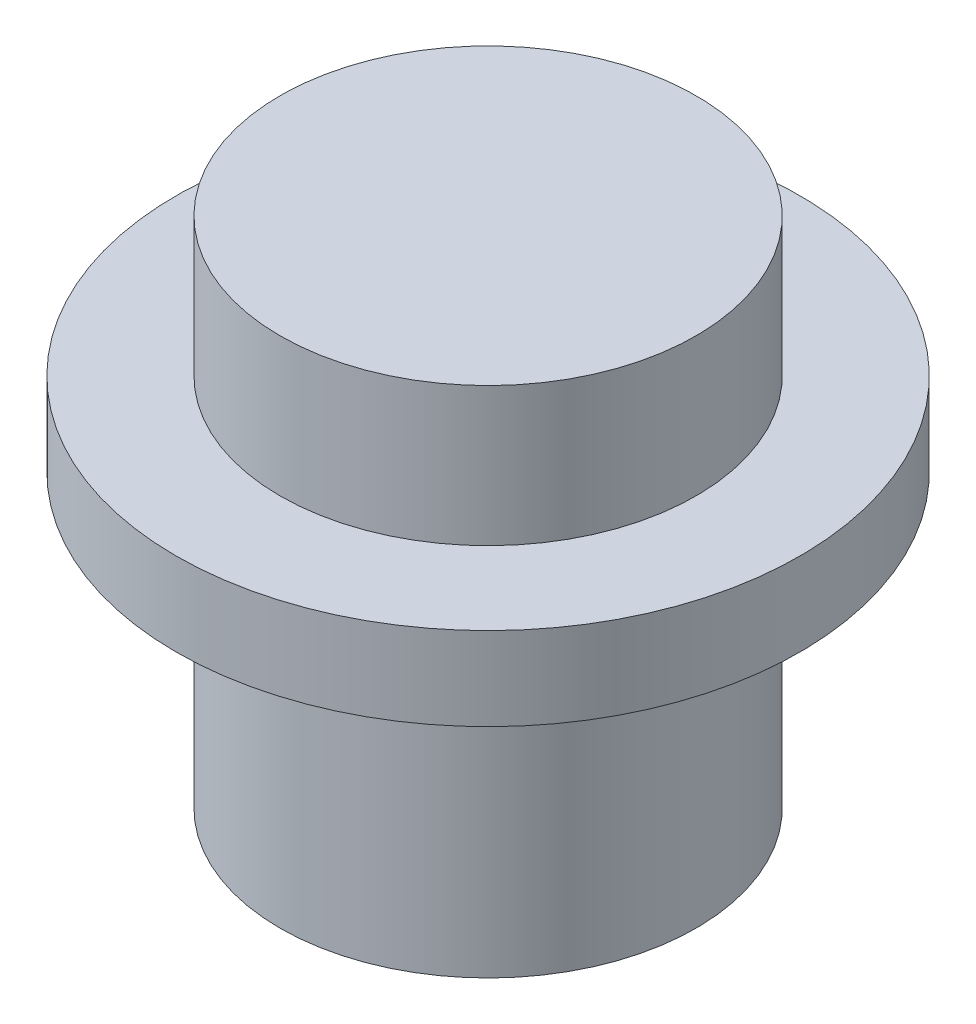
from build123d import *

# Parameters (mm, degrees)
SKETCH_1_R               = 3
PLUNGER_1_DEPTH          = 7.4
SKETCH_2_R               = 4.5
RETENTION_FLANGE_2_DEPTH = 1.2


with BuildPart() as part:
    # Эскиз1 → Plunger_1 (new body)
    with BuildSketch(Plane(origin=(0, -68, 0), x_dir=(1, 0, 0), z_dir=(0, 1, 0))):
        with Locations(Location((38, -77, 0), (0, 0, 270))):
            Circle(SKETCH_1_R)
    extrude(amount=PLUNGER_1_DEPTH)

    # Эскиз2 → Retention_flange_2 (add)
    with BuildSketch(Plane(origin=(0, -63.8, 0), x_dir=(1, 0, 0), z_dir=(0, 1, 0))):
        with Locations(Location((38, -77, 0), (0, 0, 270))):
            Circle(SKETCH_2_R)
    extrude(amount=RETENTION_FLANGE_2_DEPTH)


solid = part.part
